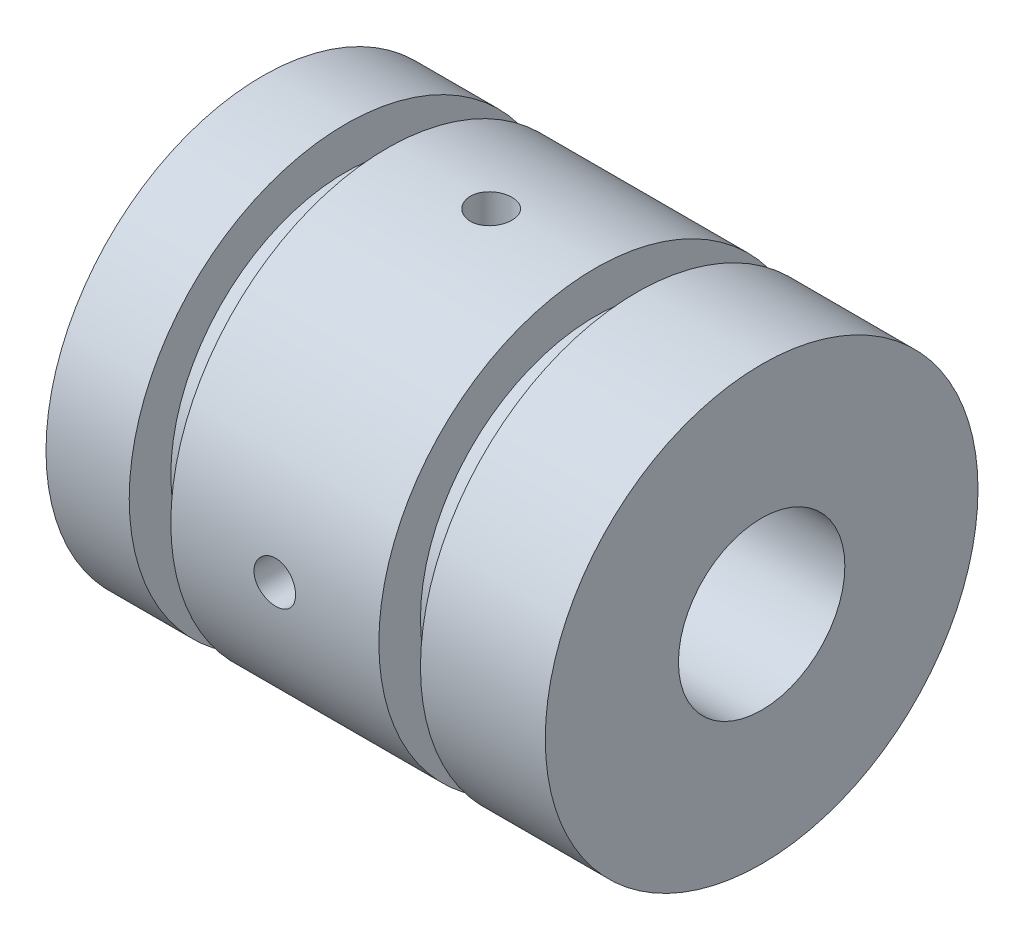
from build123d import *

# Parameters (mm, degrees)
SKETCH2_R                        = 20
CUT_EXTRUDE2_DEPTH               = 10
F_1_8_0_125_DIAMETER_HOLE1_D     = 3.175
F_1_8_0_125_DIAMETER_HOLE1_DEPTH = 7
F_1_8_0_125_DIAMETER_HOLE1_TIP   = 0.953866233
SKETCH6_R                        = 10
CUT_EXTRUDE3_DEPTH               = 50
F_1_2_0_5_DIAMETER_HOLE1_D       = 12.7
SKETCH10_R                       = 2.5
CUT_EXTRUDE8_DEPTH               = 5
SKETCH11_R                       = 2.5
CUT_EXTRUDE9_DEPTH               = 5
SKETCH12_R                       = 2.5
CUT_EXTRUDE10_DEPTH              = 5
SKETCH13_R                       = 2.5
CUT_EXTRUDE11_DEPTH              = 5
CUT_EXTRUDE12_START              = -5
SKETCH14_R                       = 2.5
CUT_EXTRUDE12_DEPTH              = 5
SKETCH15_R                       = 5
CUT_EXTRUDE13_DEPTH              = 103.225241501
SKETCH16_R                       = 45
CUT_EXTRUDE14_DEPTH              = 20
F_1_8_0_125_DIAMETER_HOLE2_D     = 3.175
F_1_8_0_125_DIAMETER_HOLE2_DEPTH = 7
F_1_8_0_125_DIAMETER_HOLE2_TIP   = 0.953866233


with BuildPart() as part:
    # Sketch1 → Revolve1 (revolve)
    with BuildSketch(Plane.XY, mode=Mode.PRIVATE) as revolve1_sk:
        Polygon((0, 0), (0, 26), (10, 26), (10, 21), (15, 21), (15, 26), (40, 26), (40, 21), (45, 21), (45, 26), (60, 26), (60, 45), (80, 45), (80, 0), align=None)
    revolve(revolve1_sk.sketch.rotate(Axis((0, 0, 0), (1, 0, 0)), 90), axis=Axis((0, 0, 0), (1, 0, 0)))

    # Sketch2 → Cut-Extrude2 (cut)
    with BuildSketch(Plane.ZY):
        Circle(SKETCH2_R)
    extrude(amount=-CUT_EXTRUDE2_DEPTH, mode=Mode.SUBTRACT)

    # 1/8 (0.125) Diameter Hole1
    with Locations(Plane.ZY.offset(-10)):
        with Locations((15.144669257, 0), (0.144669257, -15), (-14.855330743, 0), (0.144669257, 15)):
            Hole(F_1_8_0_125_DIAMETER_HOLE1_D / 2, depth=F_1_8_0_125_DIAMETER_HOLE1_DEPTH)
            with Locations((0, 0, -(F_1_8_0_125_DIAMETER_HOLE1_DEPTH + F_1_8_0_125_DIAMETER_HOLE1_TIP / 2))):  # 118° drill point
                Cone(0, F_1_8_0_125_DIAMETER_HOLE1_D / 2, F_1_8_0_125_DIAMETER_HOLE1_TIP, mode=Mode.SUBTRACT)

    # Sketch6 → Cut-Extrude3 (cut)
    with BuildSketch(Plane.ZY.offset(-10)):
        Circle(SKETCH6_R)
    extrude(amount=-CUT_EXTRUDE3_DEPTH, mode=Mode.SUBTRACT)

    # 1/2 (0.5) Diameter Hole1 (through all)
    with Locations(Plane(origin=(80, 0, 0), x_dir=(0, 0, -1), z_dir=(1, 0, 0))):
        with Locations((0, 0)):
            Hole(F_1_2_0_5_DIAMETER_HOLE1_D / 2)

    # Sketch10 → Cut-Extrude8 (cut)
    with BuildSketch(Plane(origin=(0, -26, 26), x_dir=(1, 0, 0), z_dir=(0, 0, 1))):
        with Locations((27.491787802, 26)):
            Circle(SKETCH10_R)
    extrude(amount=-CUT_EXTRUDE8_DEPTH, mode=Mode.SUBTRACT)

    # Sketch11 → Cut-Extrude9 (cut)
    with BuildSketch(Plane(origin=(0, 0, -26), x_dir=(-1, 0, 0), z_dir=(0, 0, -1))):
        with Locations((-27.5, 0)):
            Circle(SKETCH11_R)
    extrude(amount=-CUT_EXTRUDE9_DEPTH, mode=Mode.SUBTRACT)

    # Sketch12 → Cut-Extrude10 (cut)
    with BuildSketch(Plane(origin=(0, -26, 0), x_dir=(-1, 0, 0), z_dir=(0, -1, 0))):
        with Locations(Location((-27.5, 0, 0), (0, 0, 90))):
            Circle(SKETCH12_R)
    extrude(amount=-CUT_EXTRUDE10_DEPTH, mode=Mode.SUBTRACT)

    # Sketch13 → Cut-Extrude11 (cut)
    with BuildSketch(Plane(origin=(0, -21, 0), x_dir=(-1, 0, 0), z_dir=(0, -1, 0))):
        with Locations(Location((-27.5, 0, 0), (0, 0, 90))):
            Circle(SKETCH13_R)
    extrude(amount=-CUT_EXTRUDE11_DEPTH, mode=Mode.SUBTRACT)

    # Sketch14 → Cut-Extrude12 (cut)
    with BuildSketch(Plane(origin=(0, 26, 0), x_dir=(1, 0, 0), z_dir=(0, 1, 0)).offset(CUT_EXTRUDE12_START)):
        with Locations(Location((27.5, 0, 0), (0, 0, 90))):
            Circle(SKETCH14_R)
    extrude(amount=CUT_EXTRUDE12_DEPTH, mode=Mode.SUBTRACT)

    # Sketch15 → Cut-Extrude13 (cut, through all)
    with BuildSketch(Plane(origin=(80, 0, 0), x_dir=(0, 0, -1), z_dir=(1, 0, 0))):
        with Locations((0, -35)):
            Circle(SKETCH15_R)
        with Locations((-35, 0)):
            Circle(SKETCH15_R)
        with Locations((0, 35)):
            Circle(SKETCH15_R)
        with Locations((35, 0)):
            Circle(SKETCH15_R)
    extrude(amount=-CUT_EXTRUDE13_DEPTH, mode=Mode.SUBTRACT)

    # Sketch16 → Cut-Extrude14 (cut)
    with BuildSketch(Plane(origin=(80, 0, 0), x_dir=(0, 0, -1), z_dir=(1, 0, 0))):
        Circle(SKETCH16_R)
    extrude(amount=-CUT_EXTRUDE14_DEPTH, mode=Mode.SUBTRACT)

    # 1/8 (0.125) Diameter Hole2
    with Locations(Plane.ZY):
        with Locations((0, 23), (23, 0), (0, -23), (-23, 0)):
            Hole(F_1_8_0_125_DIAMETER_HOLE2_D / 2, depth=F_1_8_0_125_DIAMETER_HOLE2_DEPTH)
            with Locations((0, 0, -(F_1_8_0_125_DIAMETER_HOLE2_DEPTH + F_1_8_0_125_DIAMETER_HOLE2_TIP / 2))):  # 118° drill point
                Cone(0, F_1_8_0_125_DIAMETER_HOLE2_D / 2, F_1_8_0_125_DIAMETER_HOLE2_TIP, mode=Mode.SUBTRACT)


solid = part.part
